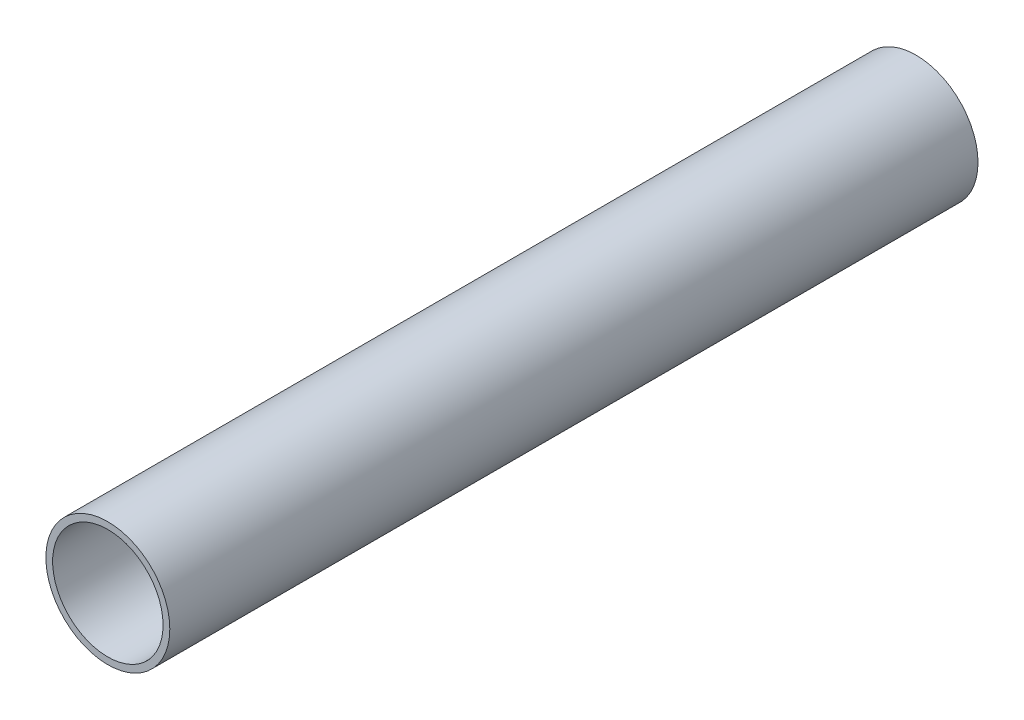
from build123d import *

# Parameters (mm, degrees)
CROQUIS1_R              = 2.3
CROQUIS1_R_2            = 2.05
SALIENTE_EXTRUIR1_DEPTH = 30


with BuildPart() as part:
    # Croquis1 → Saliente-Extruir1 (new body)
    with BuildSketch(Plane.XY):
        Circle(CROQUIS1_R)
        Circle(CROQUIS1_R_2, mode=Mode.SUBTRACT)
    extrude(amount=SALIENTE_EXTRUIR1_DEPTH)


solid = part.part
